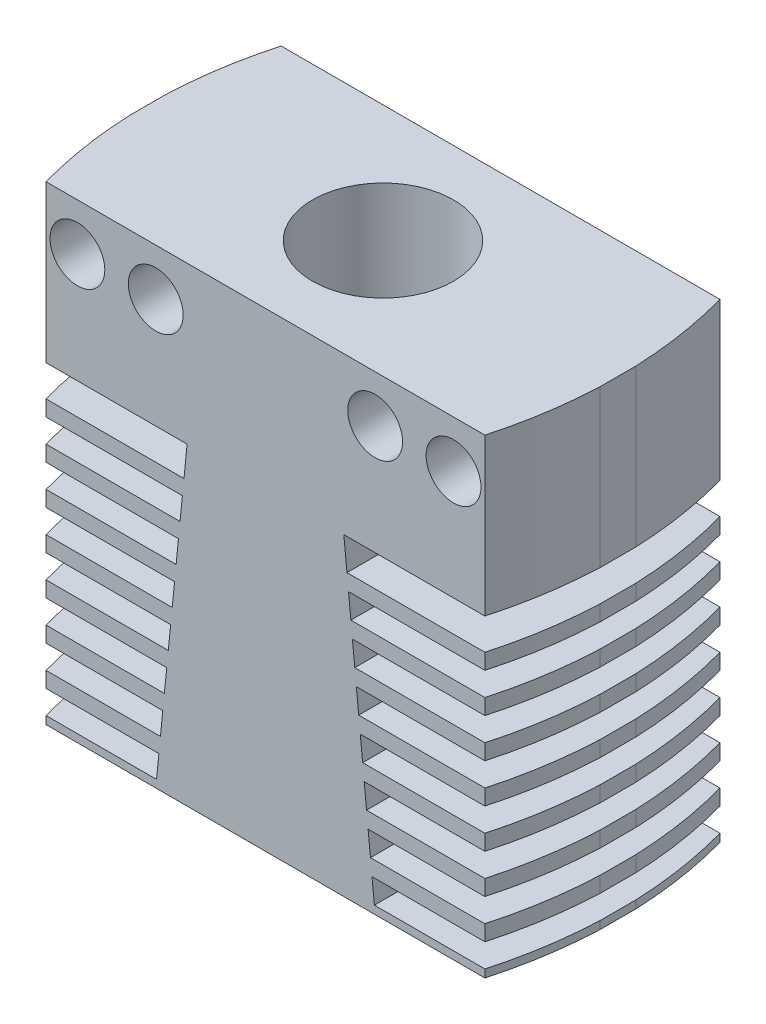
from build123d import *

# Parameters (mm, degrees)
SKETCH_1_W              = 30
SKETCH_1_H              = 30
EXTRUDE_1_DEPTH         = 15
HOLE_WIZARD_3_5_3_5_1_D = 3.5
CUT_EXTRUDE_1_DEPTH     = 46
CUT_EXTRUDE_2_REACH     = 47
SKETCH_6_R              = 4.5
CUT_EXTRUDE_3_DEPTH     = 7


with BuildPart() as part:
    # Эскиз1 → Бобышка-Вытянуть1 (new body)
    with BuildSketch(Plane.XY):
        with Locations((15, 15)):
            Rectangle(SKETCH_1_W, SKETCH_1_H)
    extrude(amount=EXTRUDE_1_DEPTH)

    # Диаметр отверстия Ø3.5 (3.5)1 (through all)
    with Locations(Plane.XY.offset(15)):
        with Locations((3, 27), (8, 27), (22, 27), (27, 27)):
            Hole(HOLE_WIZARD_3_5_3_5_1_D / 2)

    # Эскиз4 → Вырез-Вытянуть1 (cut, through all)
    with BuildSketch(Plane.XY.offset(15)):
        Polygon((0, 14.5), (9.45, 14.5), (9.3, 13), (0, 13), align=None)
        Polygon((0, 20), (10, 20), (9.8, 18), (0, 18), align=None)
        Polygon((0, 17), (9.7, 17), (9.55, 15.5), (0, 15.5), align=None)
        Polygon((0, 12), (9.2, 12), (9.05, 10.5), (0, 10.5), align=None)
        Polygon((0, 9.5), (8.95, 9.5), (8.8, 8), (0, 8), align=None)
        Polygon((0, 7), (8.7, 7), (8.55, 5.5), (0, 5.5), align=None)
        Polygon((0, 4.5), (8.45, 4.5), (8.3, 3), (0, 3), align=None)
        Polygon((0, 2), (8.2, 2), (8.05, 0.5), (0, 0.5), align=None)
        Polygon((21.8, 2), (21.95, 0.5), (30, 0.5), (30, 2), align=None)
        Polygon((21.55, 4.5), (21.7, 3), (30, 3), (30, 4.5), align=None)
        Polygon((21.3, 7), (21.45, 5.5), (30, 5.5), (30, 7), align=None)
        Polygon((21.05, 9.5), (21.2, 8), (30, 8), (30, 9.5), align=None)
        Polygon((20.8, 12), (20.95, 10.5), (30, 10.5), (30, 12), align=None)
        Polygon((20.55, 14.5), (20.7, 13), (30, 13), (30, 14.5), align=None)
        Polygon((20.3, 17), (20.45, 15.5), (30, 15.5), (30, 17), align=None)
        Polygon((30, 18), (20.2, 18), (20, 20), (30, 20), align=None)
    extrude(amount=-CUT_EXTRUDE_1_DEPTH, mode=Mode.SUBTRACT)

    # Вырез-Вытянуть2: up to this face of the body (flat: up to its plane)
    cut_extrude_2_end = Plane(part.part.faces().sort_by_distance((15, 0, 7.5))[0])
    # Эскиз5 → Вырез-Вытянуть2 (cut, up to the picked face)
    with BuildSketch(Plane(origin=(0, 30, 0), x_dir=(1, 0, 0), z_dir=(0, 1, 0)), mode=Mode.PRIVATE) as cut_extrude_2_sk1:
        with BuildLine():
            Line((30.335027773, 0), (30.335027773, -15))
            Line((30.335027773, -15), (29, -15))
            ThreePointArc((29, -15), (30.02315808, -7.5), (29, 0))
            Line((29, 0), (30.335027773, 0))
        make_face()
    cut_extrude_2_tool1 = split(extrude(cut_extrude_2_sk1.sketch, amount=-CUT_EXTRUDE_2_REACH, mode=Mode.PRIVATE), bisect_by=cut_extrude_2_end, keep=Keep.BOTH, mode=Mode.PRIVATE)
    # Эскиз5 → Вырез-Вытянуть2 (cut, up to the picked face)
    with BuildSketch(Plane(origin=(0, 30, 0), x_dir=(1, 0, 0), z_dir=(0, 1, 0)), mode=Mode.PRIVATE) as cut_extrude_2_sk2:
        with BuildLine():
            Line((-0.335027773, 0), (1, 0))
            ThreePointArc((1, 0), (-0.02315808, -7.5), (1, -15))
            Line((1, -15), (-0.335027773, -15))
            Line((-0.335027773, -15), (-0.335027773, 0))
        make_face()
    cut_extrude_2_tool2 = split(extrude(cut_extrude_2_sk2.sketch, amount=-CUT_EXTRUDE_2_REACH, mode=Mode.PRIVATE), bisect_by=cut_extrude_2_end, keep=Keep.BOTH, mode=Mode.PRIVATE)
    add(cut_extrude_2_tool1.solids().sort_by(Axis((29.667514, 30, 0.150593), (0, -1, 0)))[0], mode=Mode.SUBTRACT)
    add(cut_extrude_2_tool2.solids().sort_by(Axis((0.332486, 30, 14.849407), (0, -1, 0)))[0], mode=Mode.SUBTRACT)

    # Эскиз6 → Вырез-Вытянуть3 (cut)
    with BuildSketch(Plane(origin=(0, 30, 0), x_dir=(1, 0, 0), z_dir=(0, 1, 0))):
        with Locations(Location((15, -7.5, 0), (0, 0, 270))):
            Circle(SKETCH_6_R)
    extrude(amount=-CUT_EXTRUDE_3_DEPTH, mode=Mode.SUBTRACT)


solid = part.part
